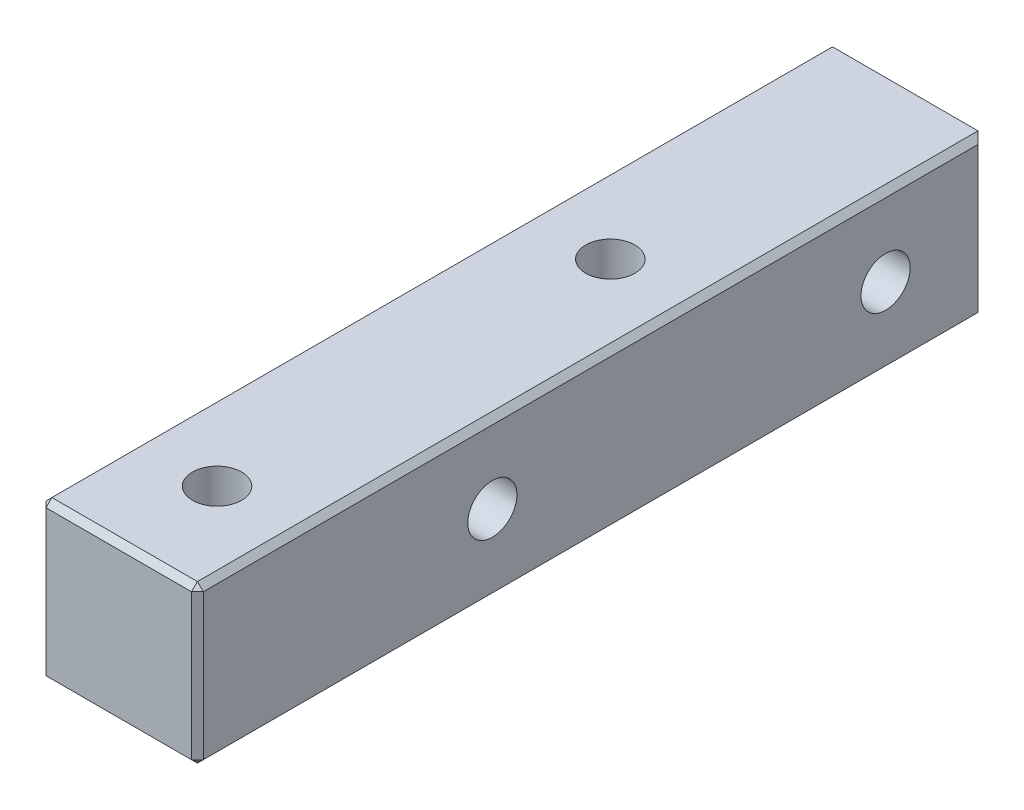
from build123d import *

# Parameters (mm, degrees)
SKETCH_1_W      = 8
SKETCH_1_H      = 8
EXTRUDE_1_DEPTH = 20
HOLE_WIZARD_1_D = 2.5
HOLE_WIZARD_2_D = 2.5
CHAMFER_1_SIZE  = 0.3


with BuildPart() as part:
    # 草图1 → 凸台-拉伸1 (new, symmetric)
    with BuildSketch(Plane.XY):
        Rectangle(SKETCH_1_W, SKETCH_1_H)
    extrude(amount=EXTRUDE_1_DEPTH, both=True)

    # Hole Wizard 1 (through all)
    with Locations(Plane.ZY.offset(4)):
        with Locations((-15, 0), (5, 0)):
            Hole(HOLE_WIZARD_1_D / 2)

    # Hole Wizard 2 (through all)
    with Locations(Plane(origin=(0, 4, 0), x_dir=(1, 0, 0), z_dir=(0, 1, 0))):
        with Locations((0, 5), (0, -15)):
            Hole(HOLE_WIZARD_2_D / 2)

    # 倒角1
    chamfer_1_edges = [part.edges().sort_by_distance(p)[0] for p in [
        (-4, 0, 20),
        (0, -4, 20),
        (4, 0, 20),
        (0, -4, -20),
        (-4, 0, -20),
        (4, 0, -20),
        (4, -4, 0),
        (-4, -4, 0),
        (-4, 4, 0),
        (4, 4, 0),
        (0, 4, 20),
    ]]
    chamfer(chamfer_1_edges, length=CHAMFER_1_SIZE)


solid = part.part
